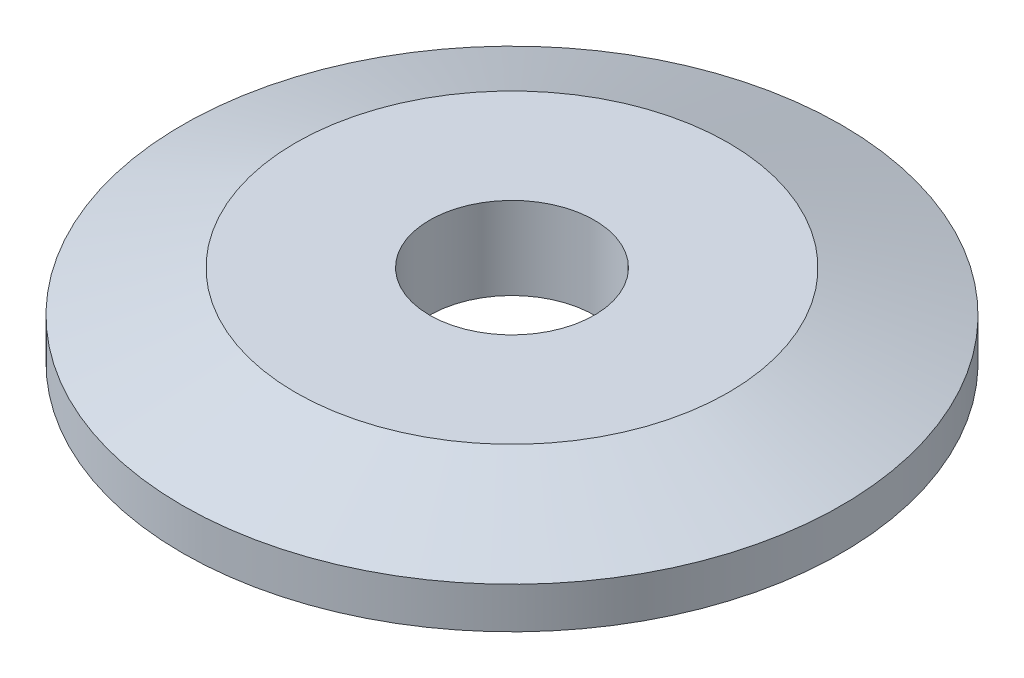
from build123d import *

# Parameters (mm, degrees)
SKETCH1_R           = 8
BOSS_EXTRUDE1_DEPTH = 2
CHAMFER1_SIZE       = 1
CHAMFER1_SIZE2      = 2.747477419
SKETCH2_R           = 2
CUT_EXTRUDE1_DEPTH  = 12.489125293


with BuildPart() as part:
    # Sketch1 → Boss-Extrude1 (new body)
    with BuildSketch(Plane(origin=(0, 0, 0), x_dir=(1, 0, 0), z_dir=(0, 1, 0))):
        with Locations(Location((0, 0, 0), (0, 0, 270))):
            Circle(SKETCH1_R)
    extrude(amount=BOSS_EXTRUDE1_DEPTH)

    # Chamfer1
    chamfer1_edges = [part.edges().sort_by_distance(p)[0] for p in [
        (0, 2, -8),
    ]]
    chamfer1_side = [part.faces().sort_by_distance(p)[0] for p in [
        (0, 1, -8),
    ]]
    chamfer(chamfer1_edges, length=CHAMFER1_SIZE, length2=CHAMFER1_SIZE2, reference=chamfer1_side[0])

    # Sketch2 → Cut-Extrude1 (cut, through all)
    with BuildSketch(Plane(origin=(0, 2, 0), x_dir=(1, 0, 0), z_dir=(0, 1, 0))):
        with Locations(Location((0, 0, 0), (0, 0, 270))):
            Circle(SKETCH2_R)
    extrude(amount=-CUT_EXTRUDE1_DEPTH, mode=Mode.SUBTRACT)


solid = part.part
